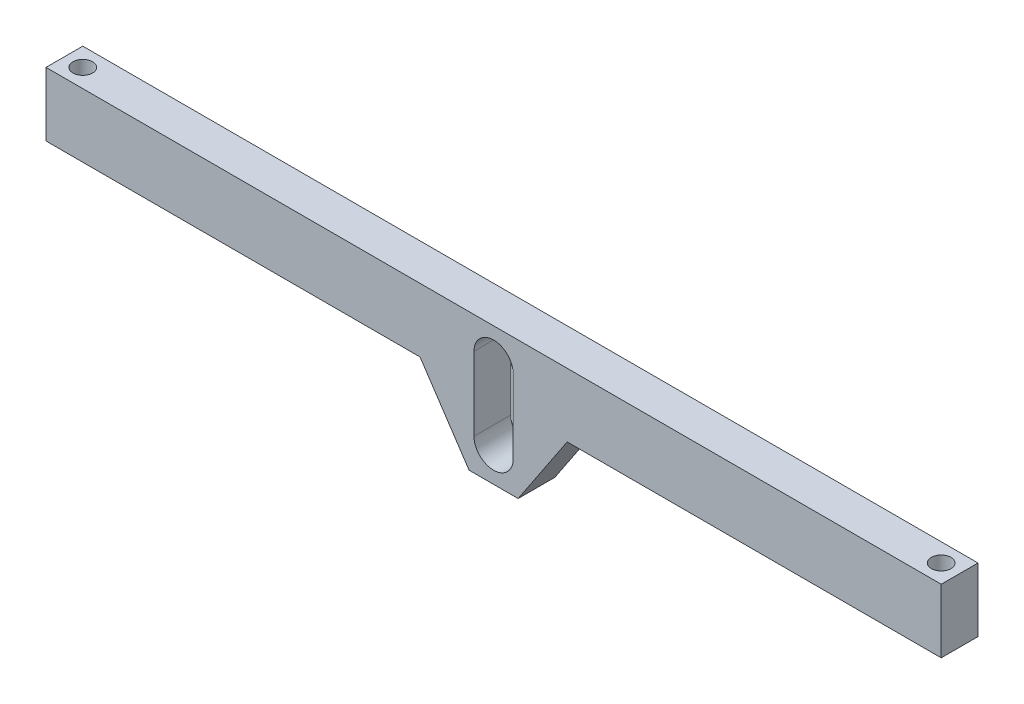
from build123d import *

# Parameters (mm, degrees)
BOSS_EXTRUDE1_DEPTH = 3
SKETCH2_R           = 0.8
CUT_EXTRUDE1_DEPTH  = 50.180347904


with BuildPart() as part:
    # Sketch1 → Boss-Extrude1 (new body)
    with BuildSketch(Plane.XY):
        Polygon((-48.720700118, 1.790980695), (-18.220700118, 1.790980695), (-14.220700118, -4.209019305), (-10.220700118, -4.209019305), (-6.220700118, 1.790980695), (24.279299882, 1.790980695), (24.279299882, 6.990980695), (-48.720700118, 6.990980695), align=None)
        with BuildLine():
            ThreePointArc((-10.620700118, -1.609019305), (-12.220700118, -3.209019305), (-13.820700118, -1.609019305))
            Line((-13.820700118, -1.609019305), (-13.820700118, 4.390980695))
            ThreePointArc((-13.820700118, 4.390980695), (-12.220700118, 5.990980695), (-10.620700118, 4.390980695))
            Line((-10.620700118, 4.390980695), (-10.620700118, -1.609019305))
        make_face(mode=Mode.SUBTRACT)
    extrude(amount=BOSS_EXTRUDE1_DEPTH)

    # Sketch2 → Cut-Extrude1 (cut, through all)
    with BuildSketch(Plane.XZ.offset(-1.790980695)):
        with Locations((22.779299882, 1.5)):
            Circle(SKETCH2_R)
        with Locations((-47.220700118, 1.5)):
            Circle(SKETCH2_R)
    extrude(amount=-CUT_EXTRUDE1_DEPTH, mode=Mode.SUBTRACT)


solid = part.part
